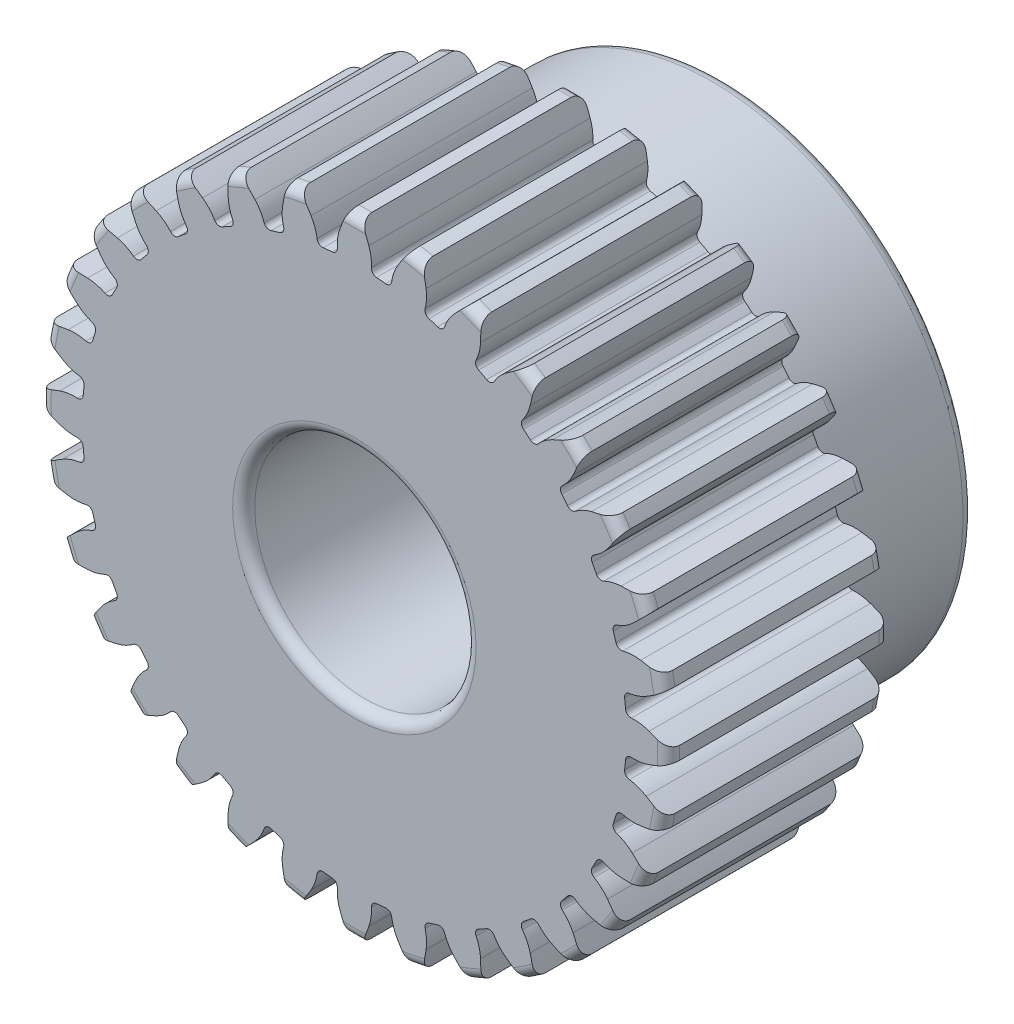
from build123d import *

# Parameters (mm, degrees)
CUT_EXTRUDE1_DEPTH = 50.714944508
CIRPATTERN1_COUNT  = 32


with BuildPart() as part:
    # Sketch3 → Revolve1 (revolve)
    with BuildSketch(Plane(origin=(0, 0, 0), x_dir=(0, 0, -1), z_dir=(1, 0, 0)), mode=Mode.PRIVATE) as revolve1_sk:
        with BuildLine():
            Line((14.9225, 9.525), (-14.9225, 9.525))
            ThreePointArc((-14.9225, 9.525), (-15.596019209, 9.803980791), (-15.875, 10.4775))
            Line((-15.875, 10.4775), (-15.875, 26.0985))
            ThreePointArc((-15.875, 26.0985), (-15.596019209, 26.772019209), (-14.9225, 27.051))
            Line((-14.9225, 27.051), (2.2225, 27.051))
            ThreePointArc((2.2225, 27.051), (2.896019209, 26.772019209), (3.175, 26.0985))
            Line((3.175, 26.0985), (3.175, 22.5425))
            ThreePointArc((3.175, 22.5425), (3.453980791, 21.868980791), (4.1275, 21.59))
            Line((4.1275, 21.59), (14.9225, 21.59))
            ThreePointArc((14.9225, 21.59), (15.596019209, 21.311019209), (15.875, 20.6375))
            Line((15.875, 20.6375), (15.875, 10.4775))
            ThreePointArc((15.875, 10.4775), (15.596019209, 9.803980791), (14.9225, 9.525))
        make_face()
    revolve(revolve1_sk.sketch.rotate(Axis((0, 0, -15.875), (0, 0, 1)), 90), axis=Axis((0, 0, -15.875), (0, 0, 1)))

    # Sketch4 → Cut-Extrude1 (cut, symmetric)
    with BuildSketch(Plane.XY.offset(15.875)):
        with BuildLine():
            ThreePointArc((4.725166642, 26.635115941), (2.651461663, 26.920742041), (0.561879456, 27.045163939))
            ThreePointArc((0.561879456, 27.045163939), (0.920312577, 26.213905745), (1.24632184, 25.369404445))
            ThreePointArc((1.24632184, 25.369404445), (1.435560455, 24.617095895), (1.467482559, 23.842008554))
            ThreePointArc((1.467482559, 23.842008554), (1.582894675, 23.500887694), (1.904105424, 23.338077827))
            ThreePointArc((1.904105424, 23.338077827), (2.295132602, 23.302872365), (2.685514546, 23.261115746))
            ThreePointArc((2.685514546, 23.261115746), (3.03231595, 23.358132158), (3.212059833, 23.67018269))
            ThreePointArc((3.212059833, 23.67018269), (3.394580602, 24.424149252), (3.726951167, 25.125083781))
            ThreePointArc((3.726951167, 25.125083781), (4.211450284, 25.889756974), (4.725166642, 26.635115941))
        make_face()
    cut_extrude1 = extrude(amount=CUT_EXTRUDE1_DEPTH, both=True, mode=Mode.SUBTRACT)

    # CirPattern1: Cut-Extrude1 ×32 about axis
    cirpattern1_axis = Axis((0, 0, 0), (0, 0, 1))
    for i in range(1, CIRPATTERN1_COUNT):
        add(cut_extrude1.rotate(cirpattern1_axis, i * 360 / CIRPATTERN1_COUNT), mode=Mode.SUBTRACT)


solid = part.part
